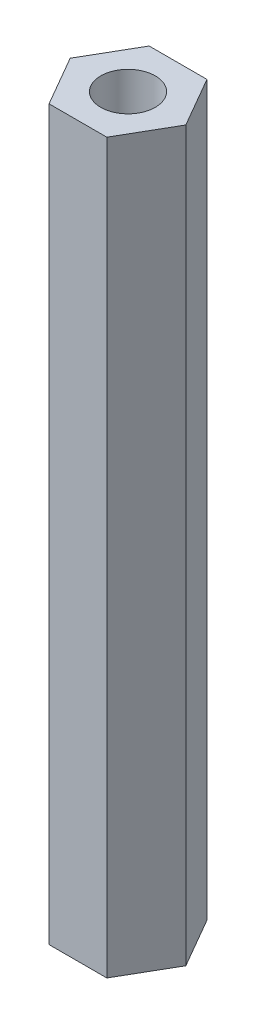
from build123d import *

# Parameters (mm, degrees)
BOSS_EXTRUDE1_DEPTH = 40
SKETCH2_R           = 1.5
CUT_EXTRUDE1_DEPTH  = 10


with BuildPart() as part:
    # Sketch1 → Boss-Extrude1 (new body)
    with BuildSketch(Plane(origin=(0, 0, 0), x_dir=(1, 0, 0), z_dir=(0, 1, 0))):
        Polygon((3.175426481, 0), (1.58771324, 2.75), (-1.58771324, 2.75), (-3.175426481, 0), (-1.58771324, -2.75), (1.58771324, -2.75), align=None)
    extrude(amount=BOSS_EXTRUDE1_DEPTH)

    # Sketch2 → Cut-Extrude1 (cut)
    with BuildSketch(Plane(origin=(0, 40, 0), x_dir=(1, 0, 0), z_dir=(0, 1, 0))):
        with Locations(Location((0, 0, 0), (0, 0, 270))):
            Circle(SKETCH2_R)
    cut_extrude1 = extrude(amount=-CUT_EXTRUDE1_DEPTH, mode=Mode.SUBTRACT)

    # Mirror1: Cut-Extrude1 across plane
    add(cut_extrude1.mirror(Plane(origin=(0, 20, 0), x_dir=(0, 0, 1), z_dir=(0, -1, 0))), mode=Mode.SUBTRACT)


solid = part.part
